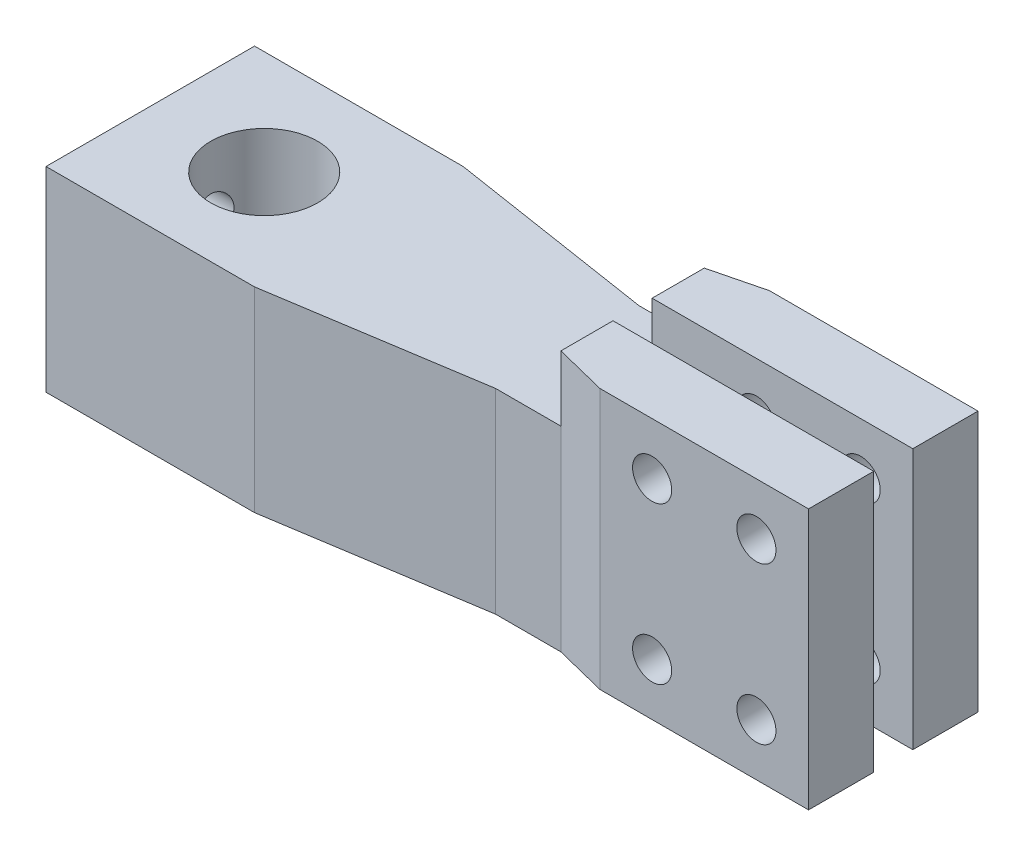
from build123d import *

# Parameters (mm, degrees)
BOSS_EXTRUDE1_DEPTH     = 7.5
SKETCH4_R               = 4.1
CUT_EXTRUDE1_DEPTH      = 10
SKETCH5_R               = 1.5
CUT_EXTRUDE2_DEPTH      = 5
CUT_EXTRUDE4_REACH      = 40.591
CUT_EXTRUDE4_END_RADIUS = 4.1
SKETCH7_R               = 1.5
BOSS_EXTRUDE2_DEPTH     = 20
SKETCH10_W              = 20
SKETCH10_H              = 3
CUT_EXTRUDE5_DEPTH      = 20
CUT_EXTRUDE6_DEPTH      = 46.249309387
CUT_EXTRUDE6_DEPTH_BACK = 46.249309387
SKETCH11_R              = 1.5


with BuildPart() as part:
    # Sketch2 → Boss-Extrude1 (new, symmetric)
    with BuildSketch(Plane(origin=(0, 0, 0), x_dir=(1, 0, 0), z_dir=(0, 1, 0))):
        Polygon((-16, -8), (-16, 8), (0, 8), (16, 5.5), (21, 5.5), (21, -5.5), (16, -5.5), (0, -8), align=None)
    extrude(amount=BOSS_EXTRUDE1_DEPTH, both=True)

    # Sketch4 → Cut-Extrude1 (cut)
    with BuildSketch(Plane(origin=(0, 7.5, 0), x_dir=(1, 0, 0), z_dir=(0, 1, 0))):
        with Locations(Location((-7.259972257, 0, 0), (0, 0, 270))):
            Circle(SKETCH4_R)
    extrude(amount=-CUT_EXTRUDE1_DEPTH, mode=Mode.SUBTRACT)

    # Sketch5 → Cut-Extrude2 (cut)
    with BuildSketch(Plane(origin=(0, -2.5, 0), x_dir=(1, 0, 0), z_dir=(0, 1, 0))):
        with Locations(Location((-7.259972257, 0, 0), (0, 0, 270))):
            Circle(SKETCH5_R)
    extrude(amount=-CUT_EXTRUDE2_DEPTH, mode=Mode.SUBTRACT)

    # Cut-Extrude4: up to this cylinder (the profile starts outside it)
    cut_extrude4_end = Plane(origin=(-7.259972257, 2.5, 0), z_dir=(0, 1, 0)) * Cylinder(CUT_EXTRUDE4_END_RADIUS, 90.382, mode=Mode.PRIVATE)
    # Sketch7 → Cut-Extrude4 (cut, up to the surface)
    with BuildSketch(Plane.ZY.offset(16), mode=Mode.PRIVATE) as cut_extrude4_sk1:
        with Locations((0, 2.5)):
            Circle(SKETCH7_R)
    cut_extrude4_tool1 = extrude(cut_extrude4_sk1.sketch, amount=-CUT_EXTRUDE4_REACH, mode=Mode.PRIVATE) - cut_extrude4_end
    add(cut_extrude4_tool1.solids().sort_by_distance((-16, 2.5, 0))[0], mode=Mode.SUBTRACT)

    # Sketch9 → Boss-Extrude2 (add)
    with BuildSketch(Plane(origin=(0, -7.5, 0), x_dir=(1, 0, 0), z_dir=(0, 1, 0))):
        Polygon((21, 5.5), (25, 6.5), (41, 6.5), (41, -6.5), (25, -6.5), (21, -5.5), align=None)
    extrude(amount=BOSS_EXTRUDE2_DEPTH)

    # Sketch10 → Cut-Extrude5 (cut)
    with BuildSketch(Plane(origin=(0, 12.5, 0), x_dir=(1, 0, 0), z_dir=(0, 1, 0))):
        with Locations((31, 0)):
            Rectangle(SKETCH10_W, SKETCH10_H)
    extrude(amount=-CUT_EXTRUDE5_DEPTH, mode=Mode.SUBTRACT)

    # Sketch11 → Cut-Extrude6 (cut, two sides: drawn at the far end of the back side and taken through both)
    with BuildSketch(Plane(origin=(0, 0, -6.5), x_dir=(-1, 0, 0), z_dir=(0, 0, -1)).offset(-CUT_EXTRUDE6_DEPTH_BACK)):
        with Locations((-37, 8.5)):
            Circle(SKETCH11_R)
        with Locations((-29, 8.5)):
            Circle(SKETCH11_R)
        with Locations((-37, -3.5)):
            Circle(SKETCH11_R)
        with Locations((-29, -3.5)):
            Circle(SKETCH11_R)
    extrude(amount=CUT_EXTRUDE6_DEPTH + CUT_EXTRUDE6_DEPTH_BACK, mode=Mode.SUBTRACT)


solid = part.part
